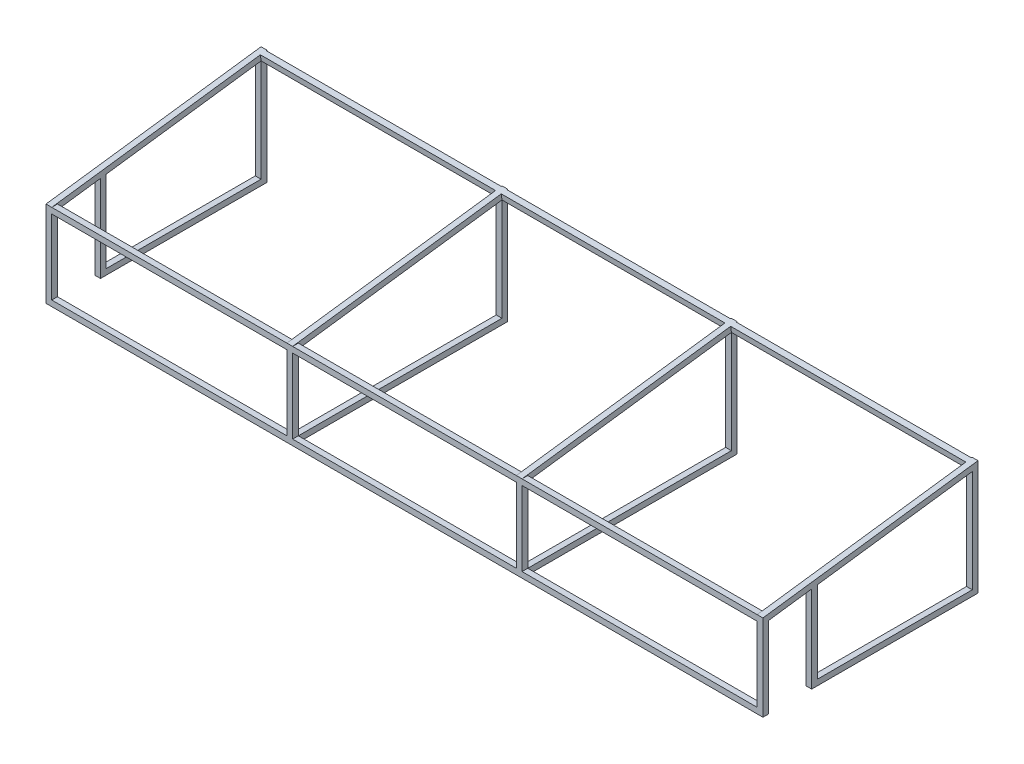
from build123d import *

# Parameters (mm, degrees)
BOSS_EXTRUDE2_START  = 1250
BOSS_EXTRUDE2_DEPTH  = 20
SKETCH3_W            = 20
SKETCH3_H            = 20
BOSS_EXTRUDE3_DEPTH  = 1250
LPATTERN1_COUNT      = 2
LPATTERN1_PITCH      = 840
MIRROR1_START        = 1250
MIRROR1_COPY_1_DEPTH = 20
SKETCH6_W            = 20
SKETCH6_H            = 20
BOSS_EXTRUDE7_DEPTH  = 730
SKETCH7_W            = 20
SKETCH7_H            = 379.823005399
BOSS_EXTRUDE8_DEPTH  = 20
CUT_EXTRUDE1_DEPTH   = 20
SKETCH9_W            = 20
SKETCH9_H            = 305.156338733
BOSS_EXTRUDE9_DEPTH  = 20
SKETCH10_W           = 150
SKETCH10_H           = 20
CUT_EXTRUDE2_DEPTH   = 20
BOSS_EXTRUDE11_DEPTH = 20


with BuildPart() as part:
    # Sketch2 → Boss-Extrude2 (new body)
    with BuildSketch(Plane(origin=(0, 0, 0), x_dir=(0, 0, -1), z_dir=(1, 0, 0)).offset(BOSS_EXTRUDE2_START)):
        Polygon((-2.643274402, -0.352436587), (-750, -100), (-750, -400), (-730, -400), (-730, -117.510327934), (0, -20.176994601), (0, 0), align=None)
    boss_extrude2 = extrude(amount=-BOSS_EXTRUDE2_DEPTH)

    # Sketch3 → Boss-Extrude3 (add, symmetric)
    with BuildSketch(Plane(origin=(0, 0, 0), x_dir=(0, 0, -1), z_dir=(1, 0, 0))):
        Polygon((0, -20.176994601), (-2.643274402, -0.352436587), (-22.467832415, -2.995710989), (-19.824558014, -22.820269002), align=None)
        with Locations((-740, -390)):
            Rectangle(SKETCH3_W, SKETCH3_H)
        with Locations((-740, -110)):
            Rectangle(SKETCH3_W, SKETCH3_H)
    extrude(amount=BOSS_EXTRUDE3_DEPTH, both=True)

    # LPattern1: Boss-Extrude2 ×2
    with Locations(*[(-i * LPATTERN1_PITCH, 0, 0) for i in range(1, LPATTERN1_COUNT)]):
        add(boss_extrude2)

    # Mirror1: Boss-Extrude2 across plane
    add(boss_extrude2.mirror(Plane(origin=(0, 0, 0), x_dir=(0, 0, 1), z_dir=(1, 0, 0))))

    # Mirror1 copy 1 sketch → Mirror1 copy 1 (add)
    with BuildSketch(Plane(origin=(840, 0, 0), x_dir=(0, 0, -1), z_dir=(-1, 0, 0)).offset(MIRROR1_START)):
        Polygon((-2.643274402, 0.352436587), (-750, 100), (-750, 400), (-730, 400), (-730, 117.510327934), (0, 20.176994601), (0, 0), align=None)
    extrude(amount=-MIRROR1_COPY_1_DEPTH)

    # Sketch6 → Boss-Extrude7 (add, through all)
    with BuildSketch(Plane(origin=(0, 0, 730), x_dir=(-1, 0, 0), z_dir=(0, 0, -1))):
        with Locations((-400, -390)):
            Rectangle(SKETCH6_W, SKETCH6_H)
        with Locations((400, -390)):
            Rectangle(SKETCH6_W, SKETCH6_H)
        with Locations((-1240, -390)):
            Rectangle(SKETCH6_W, SKETCH6_H)
        with Locations((1240, -390)):
            Rectangle(SKETCH6_W, SKETCH6_H)
    extrude(amount=BOSS_EXTRUDE7_DEPTH)

    # Sketch7 → Boss-Extrude8 (add)
    with BuildSketch(Plane(origin=(0, 0, 0), x_dir=(-1, 0, 0), z_dir=(0, 0, -1))):
        with Locations((-1240, -210.0884973)):
            Rectangle(SKETCH7_W, SKETCH7_H)
        with Locations((-400, -210.0884973)):
            Rectangle(SKETCH7_W, SKETCH7_H)
        with Locations((400, -210.0884973)):
            Rectangle(SKETCH7_W, SKETCH7_H)
        with Locations((1240, -210.0884973)):
            Rectangle(SKETCH7_W, SKETCH7_H)
    extrude(amount=-BOSS_EXTRUDE8_DEPTH)

    # Sketch8 → Cut-Extrude1 (cut)
    with BuildSketch(Plane(origin=(1250, 0, 0), x_dir=(0, 0, -1), z_dir=(1, 0, 0))):
        Polygon((-730, -400), (-730, -117.510327934), (-20, -22.843661267), (0, -20.176994601), (0, -400), align=None)
    extrude(amount=-CUT_EXTRUDE1_DEPTH, mode=Mode.SUBTRACT)

    # Sketch9 → Boss-Extrude9 (add)
    with BuildSketch(Plane.ZY.offset(1250)):
        with Locations((570, -247.421830634)):
            Rectangle(SKETCH9_W, SKETCH9_H)
    extrude(amount=-BOSS_EXTRUDE9_DEPTH)

    # Sketch10 → Cut-Extrude2 (cut)
    with BuildSketch(Plane.ZY.offset(1250)):
        with Locations((655, -390)):
            Rectangle(SKETCH10_W, SKETCH10_H)
    extrude(amount=-CUT_EXTRUDE2_DEPTH, mode=Mode.SUBTRACT)

    # Sketch11 → Boss-Extrude11 (add)
    with BuildSketch(Plane(origin=(1250, 0, 0), x_dir=(0, 0, -1), z_dir=(1, 0, 0))):
        Polygon((-560, -94.843661267), (-580, -94.843661267), (-580, -380), (-580, -400), (0, -400), (0, -20.176994601), (-20, -20.176994601), (-20, -380), (-560, -380), align=None)
    extrude(amount=-BOSS_EXTRUDE11_DEPTH)


solid = part.part
